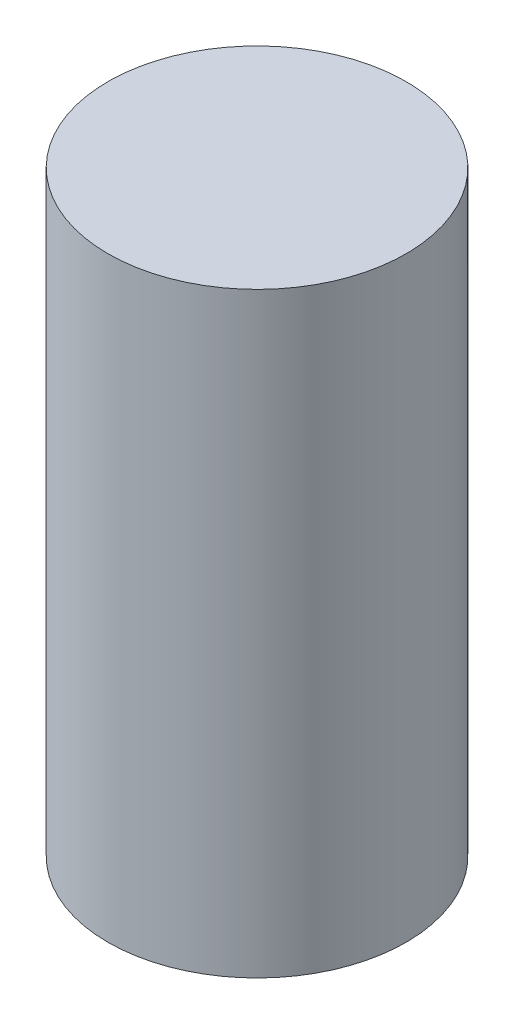
from build123d import *

# Parameters (mm, degrees)
SKETCH1_R           = 10
BOSS_EXTRUDE1_DEPTH = 40


with BuildPart() as part:
    # Sketch1 → Boss-Extrude1 (new body)
    with BuildSketch(Plane(origin=(0, 0, 0), x_dir=(1, 0, 0), z_dir=(0, 1, 0))):
        with Locations(Location((0, 0, 0), (0, 0, 270))):
            Circle(SKETCH1_R)
    extrude(amount=BOSS_EXTRUDE1_DEPTH)


solid = part.part
